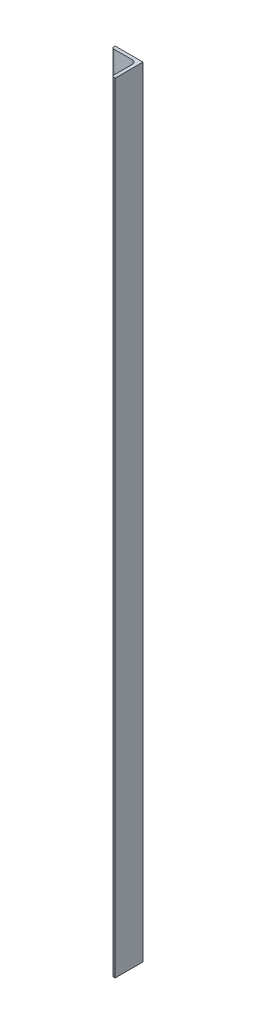
from build123d import *

# Parameters (mm, degrees)
BOSS_EXTRUDE1_DEPTH = 700
CUT_EXTRUDE1_REACH  = 705.562
SKETCH2_R           = 6


with BuildPart() as part:
    # Sketch1 → Boss-Extrude1 (new, symmetric)
    with BuildSketch(Plane(origin=(0, 0, 0), x_dir=(1, 0, 0), z_dir=(0, 1, 0))):
        with BuildLine():
            Line((0, 0), (-50, 0))
            Line((-50, 0), (-50, -2.5))
            ThreePointArc((-50, -2.5), (-48.974873734, -4.974873734), (-46.5, -6))
            Line((-46.5, -6), (-13, -6))
            ThreePointArc((-13, -6), (-8.050252532, -8.050252532), (-6, -13))
            Line((-6, -13), (-6, -46.5))
            ThreePointArc((-6, -46.5), (-4.974873734, -48.974873734), (-2.5, -50))
            Line((-2.5, -50), (0, -50))
            Line((0, -50), (0, 0))
        make_face()
    extrude(amount=BOSS_EXTRUDE1_DEPTH, both=True)

    # Sketch2 → Cut-Extrude1 (cut, up to next)
    with BuildSketch(Plane(origin=(0, 0, 0), x_dir=(-1, 0, 0), z_dir=(0, 0, -1)), mode=Mode.PRIVATE) as cut_extrude1_sk1:
        with Locations((30, 52.92)):
            Circle(SKETCH2_R)
    cut_extrude1_tool1 = extrude(cut_extrude1_sk1.sketch, amount=-CUT_EXTRUDE1_REACH, mode=Mode.PRIVATE) & part.part
    # Sketch2 → Cut-Extrude1 (cut, up to next)
    with BuildSketch(Plane(origin=(0, 0, 0), x_dir=(-1, 0, 0), z_dir=(0, 0, -1)), mode=Mode.PRIVATE) as cut_extrude1_sk2:
        with Locations((30, -52.92)):
            Circle(SKETCH2_R)
    cut_extrude1_tool2 = extrude(cut_extrude1_sk2.sketch, amount=-CUT_EXTRUDE1_REACH, mode=Mode.PRIVATE) & part.part
    add(cut_extrude1_tool1.solids().sort_by_distance((-30, 52.92, 0))[0], mode=Mode.SUBTRACT)
    add(cut_extrude1_tool2.solids().sort_by_distance((-30, -52.92, 0))[0], mode=Mode.SUBTRACT)


solid = part.part
